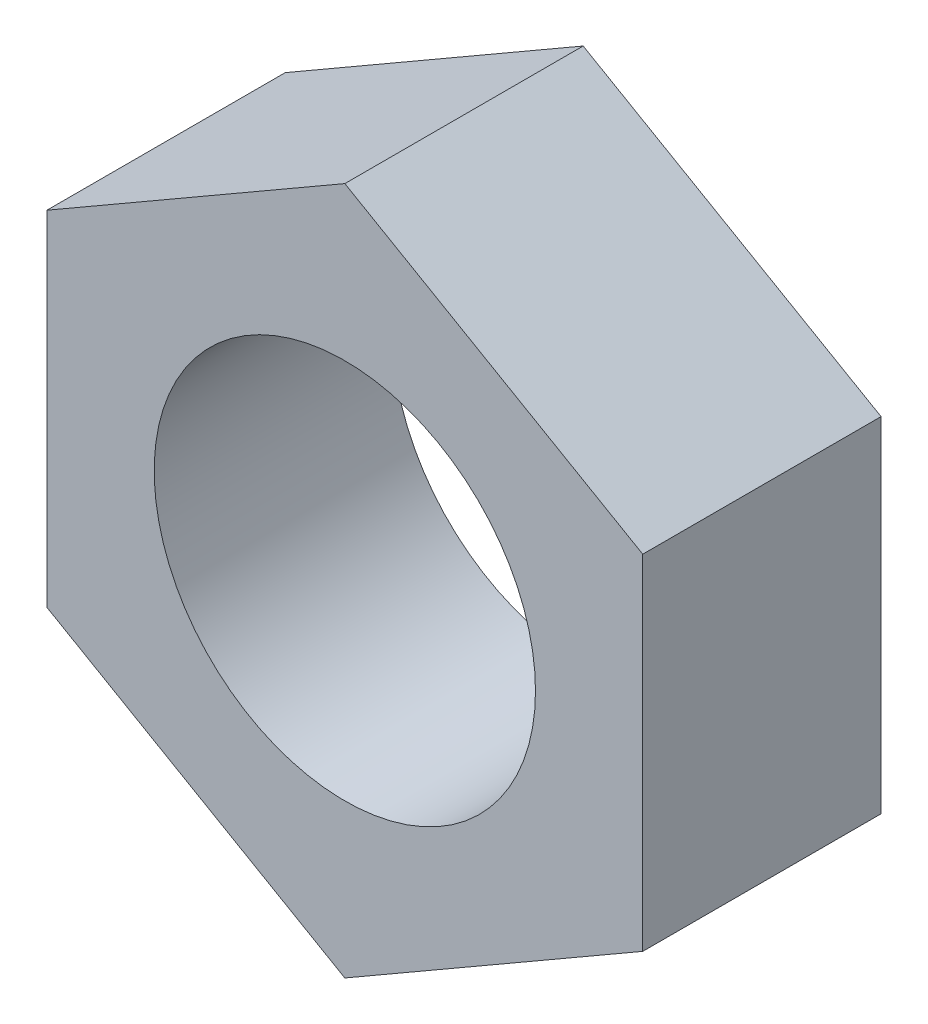
from build123d import *

# Parameters (mm, degrees)
BOSS_EXTRUDE1_DEPTH = 4.7625
SKETCH2_R           = 7.62
CUT_EXTRUDE1_DEPTH  = 30.099355663


with BuildPart() as part:
    # Sketch1 → Boss-Extrude1 (new, symmetric)
    with BuildSketch(Plane.XY):
        Polygon((0, -6.874076643), (0, 6.874076643), (11.90625, 13.748153285), (23.8125, 6.874076643), (23.8125, -6.874076643), (11.90625, -13.748153285), align=None)
    extrude(amount=BOSS_EXTRUDE1_DEPTH, both=True)

    # Sketch2 → Cut-Extrude1 (cut, through all)
    with BuildSketch(Plane.XY.offset(4.7625)):
        with Locations((11.90625, 0)):
            Circle(SKETCH2_R)
    extrude(amount=-CUT_EXTRUDE1_DEPTH, mode=Mode.SUBTRACT)


solid = part.part
